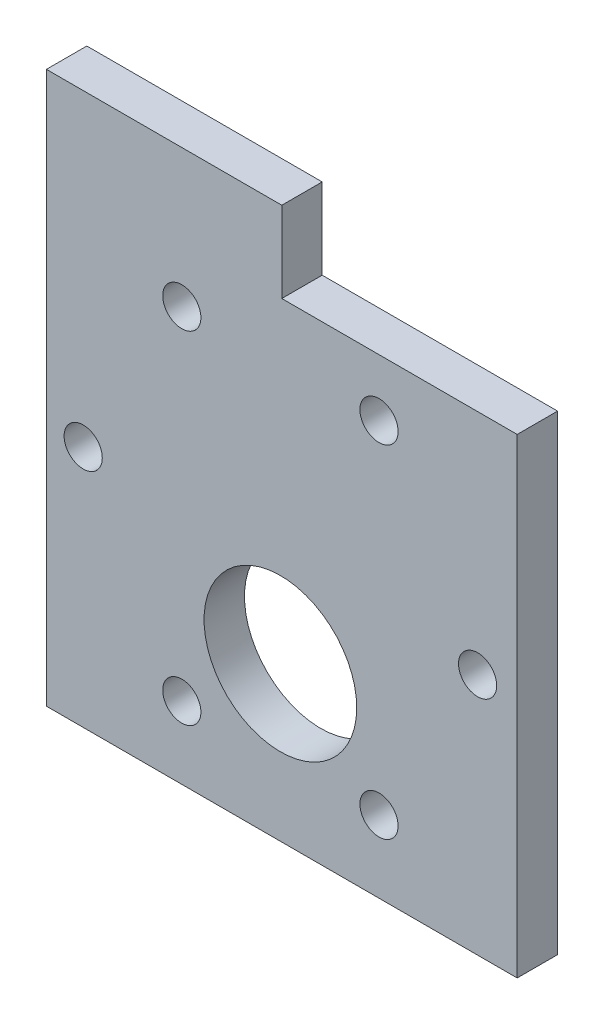
from build123d import *

# Parameters (mm, degrees)
SKETCH1_R           = 6
SKETCH1_R_2         = 1.5
BOSS_EXTRUDE1_DEPTH = 3.175


with BuildPart() as part:
    # Sketch1 → Boss-Extrude1 (new body)
    with BuildSketch(Plane.XY):
        Polygon((18.5, 0), (37, 0), (37, 37), (18.5, 37), (18.5, 43.35), (0, 43.35), (0, 37), (0, 0), align=None)
        with Locations((18.39023312, 12.089873912)):
            Circle(SKETCH1_R, mode=Mode.SUBTRACT)
        with Locations((2.89023312, 19.089873912)):
            Circle(SKETCH1_R_2, mode=Mode.SUBTRACT)
        with Locations((10.64023312, 5.666480153)):
            Circle(SKETCH1_R_2, mode=Mode.SUBTRACT)
        with Locations((26.14023312, 5.666480153)):
            Circle(SKETCH1_R_2, mode=Mode.SUBTRACT)
        with Locations((33.89023312, 19.089873912)):
            Circle(SKETCH1_R_2, mode=Mode.SUBTRACT)
        with Locations((26.14023312, 32.513267671)):
            Circle(SKETCH1_R_2, mode=Mode.SUBTRACT)
        with Locations((10.64023312, 32.513267671)):
            Circle(SKETCH1_R_2, mode=Mode.SUBTRACT)
    extrude(amount=BOSS_EXTRUDE1_DEPTH)


solid = part.part
